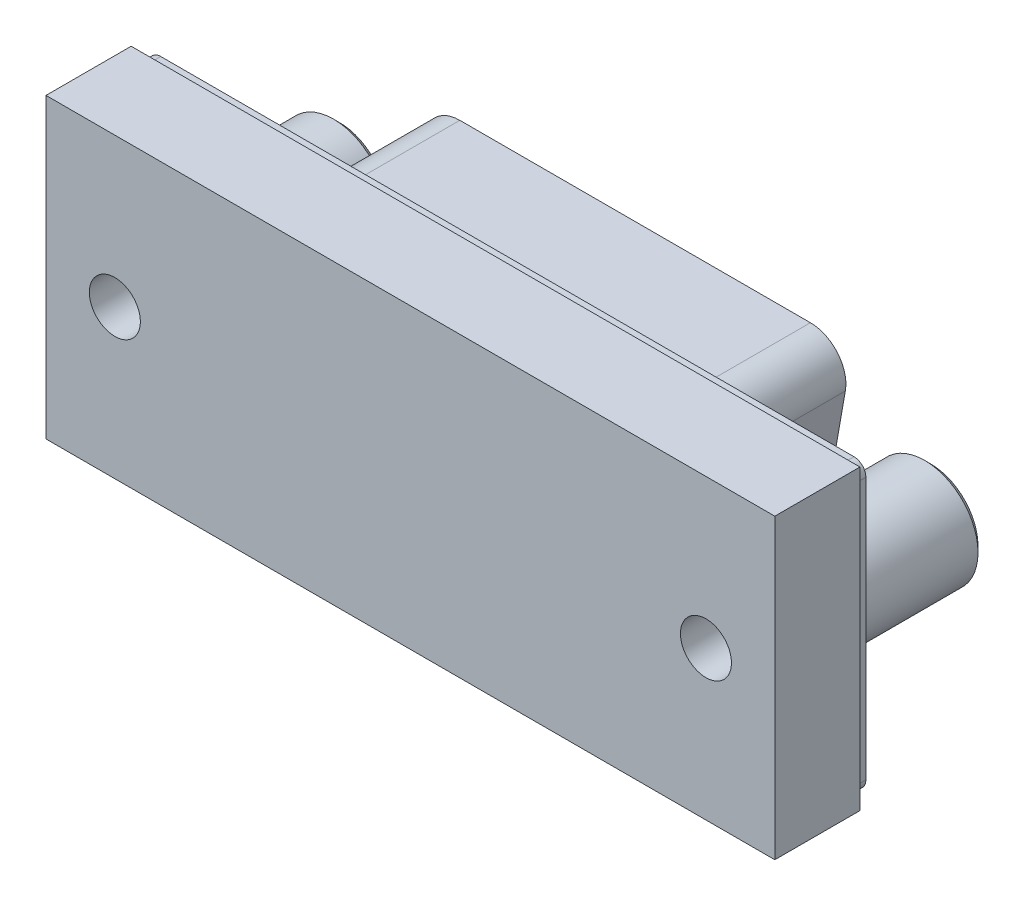
from build123d import *

# Parameters (mm, degrees)
BOSS_EXTRUDE1_DEPTH  = 30.81
BOSS_EXTRUDE2_DEPTH  = 0.5
BOSS_EXTRUDE3_DEPTH  = 5.4
CUT_EXTRUDE1_REACH   = 22.746
BOSS_EXTRUDE14_REACH = 24.041
SKETCH15_R           = 2.25
HOLE1_D              = 2.156
CHAMFER1_SIZE        = 0.25
SKETCH19_R           = 0.335
BOSS_EXTRUDE15_DEPTH = 4.99618


with BuildPart() as part:
    # Sketch1 → Boss-Extrude1 (new body)
    with BuildSketch(Plane(origin=(-15.405, 0, 0), x_dir=(0, -1, 0), z_dir=(-1, 0, 0))):
        Polygon((-12.58, -3.6), (0, -3.6), (0, 0), (-3.599999999, 0), (-12.58, 0), align=None)
    extrude(amount=-BOSS_EXTRUDE1_DEPTH)

    # Sketch2 → Boss-Extrude2 (add)
    with BuildSketch(Plane(origin=(0, 0, -4.1), x_dir=(-1, 0, 0), z_dir=(0, 0, -1))):
        with BuildLine():
            Line((-15.155, 11.83), (-15.155, 0.75))
            ThreePointArc((-15.155, 0.75), (-15.008553391, 0.396446609), (-14.655, 0.25))
            Line((-14.655, 0.25), (14.655, 0.25))
            ThreePointArc((14.655, 0.25), (15.008553391, 0.396446609), (15.155, 0.75))
            Line((15.155, 0.75), (15.155, 11.83))
            ThreePointArc((15.155, 11.83), (15.008553391, 12.183553391), (14.655, 12.33))
            Line((14.655, 12.33), (-14.655, 12.33))
            ThreePointArc((-14.655, 12.33), (-15.008553391, 12.183553391), (-15.155, 11.83))
        make_face()
    extrude(amount=-BOSS_EXTRUDE2_DEPTH)

    # Sketch3 → Boss-Extrude3 (add)
    with BuildSketch(Plane(origin=(0, 0, -9.5), x_dir=(-1, 0, 0), z_dir=(0, 0, -1))):
        with BuildLine():
            Line((-8.887403877, 9.154527733), (-7.785360247, 2.904527733))
            ThreePointArc((-7.785360247, 2.904527733), (-7.272330032, 2.015933335), (-6.308148618, 1.665))
            Line((-6.308148618, 1.665), (6.308148618, 1.665))
            ThreePointArc((6.308148618, 1.665), (7.272330032, 2.015933335), (7.785360247, 2.904527733))
            Line((7.785360247, 2.904527733), (8.887403877, 9.154527733))
            ThreePointArc((8.887403877, 9.154527733), (8.559258912, 10.379181415), (7.410192247, 10.915))
            Line((7.410192247, 10.915), (-7.410192247, 10.915))
            ThreePointArc((-7.410192247, 10.915), (-8.559258912, 10.379181415), (-8.887403877, 9.154527733))
        make_face()
    extrude(amount=-BOSS_EXTRUDE3_DEPTH)

    # Sketch4 → Cut-Extrude1 (cut, up to next)
    with BuildSketch(Plane.XY.offset(-3.6), mode=Mode.PRIVATE) as cut_extrude1_sk1:
        with BuildLine():
            Line((7.410192247, 10.415), (-7.410192247, 10.415))
            ThreePointArc((-7.410192247, 10.415), (-8.17623669, 10.05778761), (-8.395, 9.241351822))
            Line((-8.395, 9.241351822), (-7.292956371, 2.991351822))
            ThreePointArc((-7.292956371, 2.991351822), (-6.950936227, 2.398955557), (-6.308148618, 2.165))
            Line((-6.308148618, 2.165), (6.308148618, 2.165))
            ThreePointArc((6.308148618, 2.165), (6.950936227, 2.398955557), (7.292956371, 2.991351822))
            Line((7.292956371, 2.991351822), (8.395, 9.241351822))
            ThreePointArc((8.395, 9.241351822), (8.17623669, 10.05778761), (7.410192247, 10.415))
        make_face()
    cut_extrude1_tool1 = extrude(cut_extrude1_sk1.sketch, amount=-CUT_EXTRUDE1_REACH, mode=Mode.PRIVATE) & part.part
    add(cut_extrude1_tool1.solids().sort_by_distance((0, 6.407458, -3.6))[0], mode=Mode.SUBTRACT)

    # Sketch15 → Boss-Extrude14 (add, up to next)
    with BuildSketch(Plane(origin=(0, 0, -9.5), x_dir=(-1, 0, 0), z_dir=(0, 0, -1)), mode=Mode.PRIVATE) as boss_extrude14_sk1:
        with Locations((-12.495, 6.29)):
            Circle(SKETCH15_R)
    boss_extrude14_tool1 = extrude(boss_extrude14_sk1.sketch, amount=-BOSS_EXTRUDE14_REACH, mode=Mode.PRIVATE) - part.part
    # Sketch15 → Boss-Extrude14 (add, up to next)
    with BuildSketch(Plane(origin=(0, 0, -9.5), x_dir=(-1, 0, 0), z_dir=(0, 0, -1)), mode=Mode.PRIVATE) as boss_extrude14_sk2:
        with Locations((12.495, 6.29)):
            Circle(SKETCH15_R)
    boss_extrude14_tool2 = extrude(boss_extrude14_sk2.sketch, amount=-BOSS_EXTRUDE14_REACH, mode=Mode.PRIVATE) - part.part
    add(boss_extrude14_tool1.solids().sort_by_distance((12.495, 6.29, -9.5))[0])
    add(boss_extrude14_tool2.solids().sort_by_distance((-12.495, 6.29, -9.5))[0])

    # Hole1 (through all)
    with Locations(Plane(origin=(0, 0, -9.5), x_dir=(-1, 0, 0), z_dir=(0, 0, -1))):
        with Locations((12.495, 6.29), (-12.495, 6.29)):
            Hole(HOLE1_D / 2)

    # Chamfer1
    chamfer1_edges = [part.edges().sort_by_distance(p)[0] for p in [
        (14.745, 6.29, -9.5),
        (-10.245, 6.29, -9.5),
        (11.417, 6.29, -9.5),
        (-13.573, 6.29, -9.5),
    ]]
    chamfer(chamfer1_edges, length=CHAMFER1_SIZE)

    # Sketch19 → Boss-Extrude15 (add)
    with BuildSketch(Plane(origin=(0, 0, -3.6), x_dir=(-1, 0, 0), z_dir=(0, 0, -1))):
        with Locations(Location((-5.48, 7.71, 0), (0, 0, 180))):
            Circle(SKETCH19_R)
        with Locations(Location((-2.74, 7.71, 0), (0, 0, 180))):
            Circle(SKETCH19_R)
        with Locations(Location((0, 7.71, 0), (0, 0, 180))):
            Circle(SKETCH19_R)
        with Locations(Location((2.74, 7.71, 0), (0, 0, 180))):
            Circle(SKETCH19_R)
        with Locations(Location((5.48, 7.71, 0), (0, 0, 180))):
            Circle(SKETCH19_R)
        with Locations(Location((4.11, 4.87, 0), (0, 0, 180))):
            Circle(SKETCH19_R)
        with Locations(Location((1.37, 4.87, 0), (0, 0, 180))):
            Circle(SKETCH19_R)
        with Locations(Location((-1.37, 4.87, 0), (0, 0, 180))):
            Circle(SKETCH19_R)
        with Locations(Location((-4.11, 4.87, 0), (0, 0, 180))):
            Circle(SKETCH19_R)
    extrude(amount=BOSS_EXTRUDE15_DEPTH)


solid = part.part
